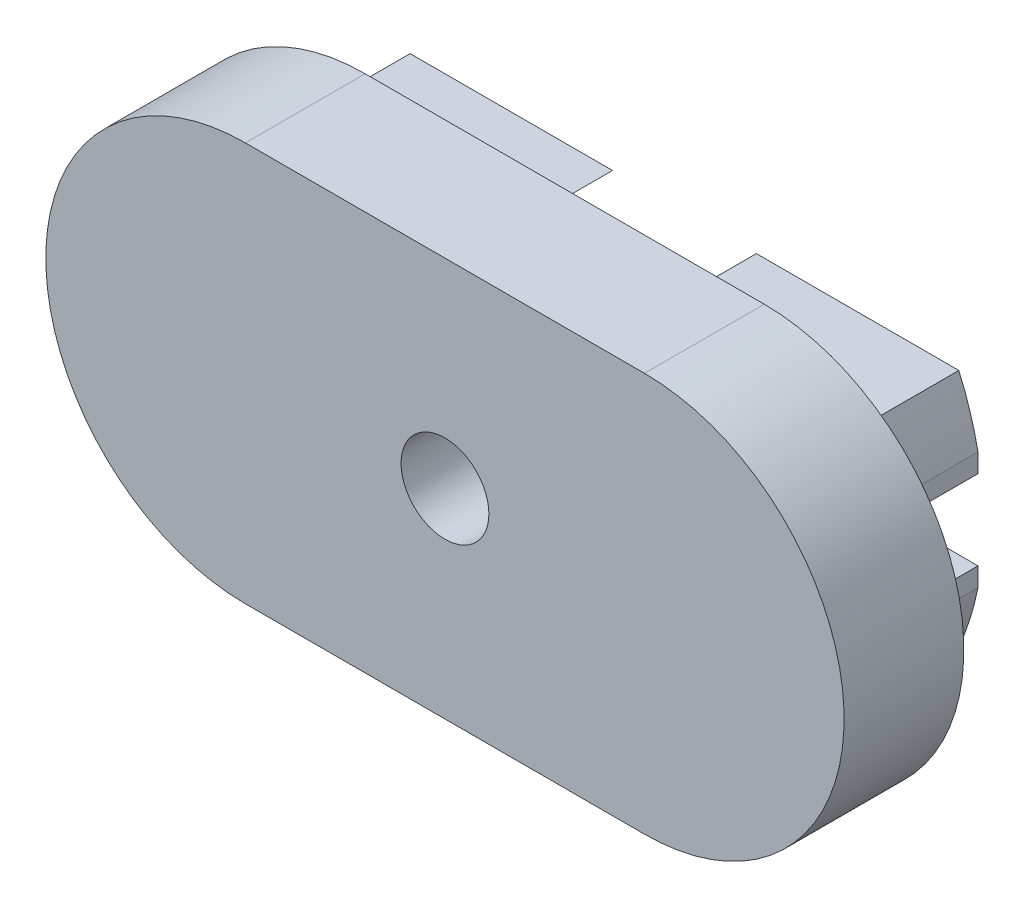
from build123d import *

# Parameters (mm, degrees)
SKETCH_1_R      = 1.1
EXTRUDE_1_DEPTH = 3
EXTRUDE_2_DEPTH = 3


with BuildPart() as part:
    # 草图1 → 凸台-拉伸1 (new body)
    with BuildSketch(Plane.XY):
        with BuildLine():
            Line((-5, 5), (5, 5))
            ThreePointArc((5, 5), (10, 0), (5, -5))
            Line((5, -5), (-5, -5))
            ThreePointArc((-5, -5), (-10, 0), (-5, 5))
        make_face()
        Circle(SKETCH_1_R, mode=Mode.SUBTRACT)
    extrude(amount=EXTRUDE_1_DEPTH)

    # 草图3 → 凸台-拉伸2 (add)
    with BuildSketch(Plane(origin=(0, 0, 0), x_dir=(-1, 0, 0), z_dir=(0, 0, -1))):
        with BuildLine():
            Line((-1.802775638, 3), (-6.873863542, 3))
            ThreePointArc((-6.873863542, 3), (-7.154882442, 2.248923573), (-7.354101966, 1.472135955))
            Line((-7.354101966, 1.472135955), (-7.354101966, 1))
            Line((-7.354101966, 1), (-3.354101966, 1))
            ThreePointArc((-3.354101966, 1), (-2.765564437, 2.145146462), (-1.802775638, 3))
        make_face()
        with BuildLine():
            Line((-7.354101966, -1.472135955), (-7.354101966, -1))
            Line((-7.354101966, -1), (-3.354101966, -1))
            ThreePointArc((-3.354101966, -1), (-2.765564437, -2.145146462), (-1.802775638, -3))
            Line((-1.802775638, -3), (-6.873863542, -3))
            ThreePointArc((-6.873863542, -3), (-7.154882442, -2.248923573), (-7.354101966, -1.472135955))
        make_face()
        with BuildLine():
            Line((1.802775638, -3), (6.873863542, -3))
            ThreePointArc((6.873863542, -3), (7.154882442, -2.248923573), (7.354101966, -1.472135955))
            Line((7.354101966, -1.472135955), (7.354101966, -1))
            Line((7.354101966, -1), (3.354101966, -1))
            ThreePointArc((3.354101966, -1), (2.765564437, -2.145146462), (1.802775638, -3))
        make_face()
        with BuildLine():
            Line((7.354101966, 1.472135955), (7.354101966, 1))
            Line((7.354101966, 1), (3.354101966, 1))
            ThreePointArc((3.354101966, 1), (2.765564437, 2.145146462), (1.802775638, 3))
            Line((1.802775638, 3), (6.873863542, 3))
            ThreePointArc((6.873863542, 3), (7.154882442, 2.248923573), (7.354101966, 1.472135955))
        make_face()
    extrude(amount=EXTRUDE_2_DEPTH)


solid = part.part
